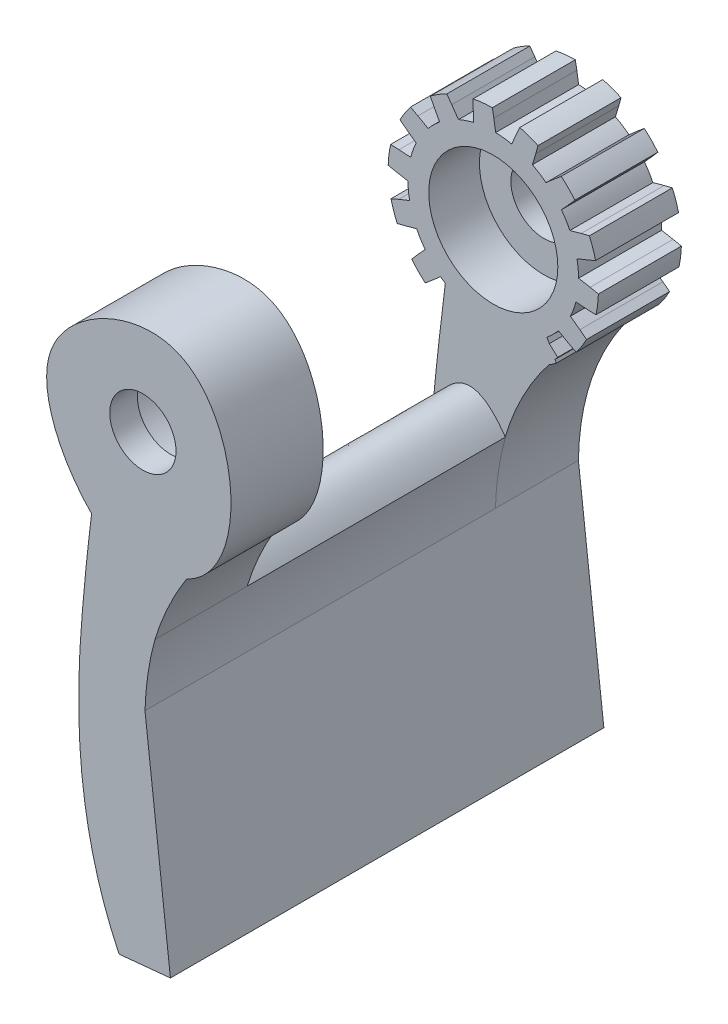
from build123d import *

# Parameters (mm, degrees)
BOSS_EXTRUDE1_DEPTH      = 2
BOSS_EXTRUDE1_DEPTH_BACK = 7
BOSS_EXTRUDE3_DEPTH      = 9
SKETCH6_R                = 7
SKETCH6_R_2              = 3.69685312
BOSS_EXTRUDE4_DEPTH      = 3
BOSS_EXTRUDE5_DEPTH      = 38
SKETCH8_R                = 7
BOSS_EXTRUDE6_DEPTH      = 10
SKETCH9_R                = 7
SKETCH9_R_2              = 3.591571222
BOSS_EXTRUDE7_DEPTH      = 3
SKETCH10_R               = 7
CUT_EXTRUDE1_DEPTH       = 5.5
SKETCH11_R               = 3.591571222
CUT_EXTRUDE2_DEPTH       = 71.546467667


with BuildPart() as part:
    # Sketch2 → Boss-Extrude1 (new, two sides: drawn at the far end of the back side and taken through both)
    with BuildSketch(Plane.XY.offset(-BOSS_EXTRUDE1_DEPTH_BACK)):
        with BuildLine():
            Line((17.593003447, 3.447921134), (18.432689254, 3.812129579))
            ThreePointArc((18.432689254, 3.812129579), (18.142308848, 4.822341152), (17.760116965, 5.801513031))
            Line((17.760116965, 5.801513031), (16.871688472, 5.581479263))
            Line((16.871688472, 5.581479263), (15.649099733, 5.241598415))
            ThreePointArc((15.649099733, 5.241598415), (15.22663553, 6.009376293), (14.733410626, 6.733729845))
            Line((14.733410626, 6.733729845), (15.590096731, 7.669855443))
            Line((15.590096731, 7.669855443), (16.188603379, 8.362321932))
            ThreePointArc((16.188603379, 8.362321932), (15.488665299, 9.146499772), (14.719475556, 9.862876308))
            Line((14.719475556, 9.862876308), (14.014498216, 9.279158058))
            Line((14.014498216, 9.279158058), (13.060452596, 8.442474621))
            ThreePointArc((13.060452596, 8.442474621), (12.346699165, 8.950918239), (11.588033655, 9.389535972))
            Line((11.588033655, 9.389535972), (11.95371149, 10.604658163))
            Line((11.95371149, 10.604658163), (12.192497398, 11.488231214))
            ThreePointArc((12.192497398, 11.488231214), (11.221632964, 11.891059284), (10.217792822, 12.202753318))
            Line((10.217792822, 12.202753318), (9.835896044, 11.370963143))
            Line((9.835896044, 11.370963143), (9.33935398, 10.203192533))
            ThreePointArc((9.33935398, 10.203192533), (8.475678941, 10.351598396), (7.601835833, 10.417606691))
            Line((7.601835833, 10.417606691), (7.404078418, 11.671055622))
            Line((7.404078418, 11.671055622), (7.235849109, 12.570732756))
            ThreePointArc((7.235849109, 12.570732756), (6.18634993, 12.512426015), (5.14668224, 12.357702722))
            Line((5.14668224, 12.357702722), (5.163505363, 11.442586867))
            Line((5.163505363, 11.442586867), (5.222813101, 10.175020376))
            ThreePointArc((5.222813101, 10.175020376), (4.380277888, 9.933994883), (3.564332526, 9.614319987))
            Line((3.564332526, 9.614319987), (2.842308143, 10.657834724))
            Line((2.842308143, 10.657834724), (2.300383494, 11.395423851))
            ThreePointArc((2.300383494, 11.395423851), (1.380115753, 10.887530665), (0.510539453, 10.297034891))
            Line((0.510539453, 10.297034891), (0.922750452, 9.479843274))
            Line((0.922750452, 9.479843274), (1.526161366, 8.363537991))
            ThreePointArc((1.526161366, 8.363537991), (0.871640411, 7.780819197), (0.275200782, 7.138776643))
            Line((0.275200782, 7.138776643), (-0.828084785, 7.765676295))
            Line((-0.828084785, 7.765676295), (-1.636369952, 8.195088843))
            ThreePointArc((-1.636369952, 8.195088843), (-2.245135941, 7.338203686), (-2.772390602, 6.42889036))
            Line((-2.772390602, 6.42889036), (-2.04643517, 5.871477804))
            Line((-2.04643517, 5.871477804), (-1.018434012, 5.12753168))
            ThreePointArc((-1.018434012, 5.12753168), (-1.355304806, 4.318534189), (-1.61410652, 3.481288379))
            Line((-1.61410652, 3.481288379), (-2.880134034, 3.567407782))
            Line((-2.880134034, 3.567407782), (-3.794688927, 3.603593329))
            ThreePointArc((-3.794688927, 3.603593329), (-3.971379595, 2.567432815), (-4.051883364, 1.519402593))
            Line((-4.051883364, 1.519402593), (-3.155967876, 1.332171491))
            Line((-3.155967876, 1.332171491), (-1.90698471, 1.107932181))
            ThreePointArc((-1.90698471, 1.107932181), (-1.859483953, 0.232887867), (-1.729388897, -0.633734398))
            Line((-1.729388897, -0.633734398), (-2.907406081, -1.105452248))
            Line((-2.907406081, -1.105452248), (-3.747091888, -1.469660694))
            ThreePointArc((-3.747091888, -1.469660694), (-3.456711482, -2.479872267), (-3.0745196, -3.459044145))
            Line((-3.0745196, -3.459044145), (-2.186091107, -3.239010378))
            Line((-2.186091107, -3.239010378), (-0.963502367, -2.899129529))
            ThreePointArc((-0.963502367, -2.899129529), (-0.541038164, -3.666907408), (-0.047813261, -4.391260959))
            Line((-0.047813261, -4.391260959), (-0.904499365, -5.327386558))
            Line((-0.904499365, -5.327386558), (-1.503006014, -6.019853046))
            ThreePointArc((-1.503006014, -6.019853046), (-0.803067933, -6.804030887), (-0.03387819, -7.520407423))
            Line((-0.03387819, -7.520407423), (0.67109915, -6.936689172))
            Line((0.67109915, -6.936689172), (1.625144769, -6.100005735))
            ThreePointArc((1.625144769, -6.100005735), (2.3388982, -6.608449353), (3.097563711, -7.047067087))
            Line((3.097563711, -7.047067087), (2.731885876, -8.262189278))
            Line((2.731885876, -8.262189278), (2.493099968, -9.145762328))
            ThreePointArc((2.493099968, -9.145762328), (3.463964401, -9.548590398), (4.467804544, -9.860284433))
            Line((4.467804544, -9.860284433), (4.849701322, -9.028494257))
            Line((4.849701322, -9.028494257), (5.346243386, -7.860723648))
            ThreePointArc((5.346243386, -7.860723648), (6.209918425, -8.009129511), (7.083761533, -8.075137806))
            Line((7.083761533, -8.075137806), (7.281518948, -9.328586736))
            Line((7.281518948, -9.328586736), (7.449748257, -10.22826387))
            ThreePointArc((7.449748257, -10.22826387), (8.499247436, -10.16995713), (9.538915126, -10.015233837))
            Line((9.538915126, -10.015233837), (9.522092003, -9.100117982))
            Line((9.522092003, -9.100117982), (9.462784265, -7.83255149))
            ThreePointArc((9.462784265, -7.83255149), (10.305319478, -7.591525998), (11.12126484, -7.271851101))
            Line((11.12126484, -7.271851101), (11.843289223, -8.315365839))
            Line((11.843289223, -8.315365839), (12.385213872, -9.052954966))
            ThreePointArc((12.385213872, -9.052954966), (13.305481612, -8.54506178), (14.175057913, -7.954566005))
            Line((14.175057913, -7.954566005), (13.762846914, -7.137374389))
            Line((13.762846914, -7.137374389), (13.159436, -6.021069105))
            ThreePointArc((13.159436, -6.021069105), (13.813956955, -5.438350311), (14.410396584, -4.796307757))
            Line((14.410396584, -4.796307757), (15.513682151, -5.42320741))
            Line((15.513682151, -5.42320741), (16.321967317, -5.852619957))
            ThreePointArc((16.321967317, -5.852619957), (16.930733307, -4.9957348), (17.457987967, -4.086421474))
            Line((17.457987967, -4.086421474), (16.732032536, -3.529008918))
            Line((16.732032536, -3.529008918), (15.704031377, -2.785062794))
            ThreePointArc((15.704031377, -2.785062794), (16.040902172, -1.976065303), (16.299703886, -1.138819493))
            Line((16.299703886, -1.138819493), (17.565731399, -1.224938896))
            Line((17.565731399, -1.224938896), (18.480286292, -1.261124443))
            ThreePointArc((18.480286292, -1.261124443), (18.656976961, -0.22496393), (18.737480729, 0.823066292))
            Line((18.737480729, 0.823066292), (17.841565242, 1.010297394))
            Line((17.841565242, 1.010297394), (16.592582076, 1.234536705))
            ThreePointArc((16.592582076, 1.234536705), (16.545081318, 2.109581019), (16.414986263, 2.976203284))
            Line((16.414986263, 2.976203284), (17.593003447, 3.447921134))
        make_face()
    extrude(amount=BOSS_EXTRUDE1_DEPTH + BOSS_EXTRUDE1_DEPTH_BACK)

    # Sketch5 → Boss-Extrude3 (add)
    with BuildSketch(Plane.XY.offset(2)):
        with BuildLine():
            Line((14.323069399, -7.330284288), (11.497184032, -4.736041982))
            Line((11.497184032, -4.736041982), (2.348634103, -4.736041982))
            add(Edge.make_bspline(
                [(2.348634103, -4.736041982), (0.628552499, -19.32789347), (-1.912663, -35.361500183), (4.763482553, -49.160053836)],
                knots=[0, 0, 0, 0, 1, 1, 1, 1], degree=3))
            Line((4.763482553, -49.160053836), (10.332905106, -48.613760737))
            Line((10.332905106, -48.613760737), (7.574511186, -24.888738823))
            add(Edge.make_bspline(
                [(14.323069399, -7.330284288), (7.759285057, -14.975557189), (7.574511186, -24.888738823)],
                knots=[0, 0, 0, 1, 1, 1], degree=2))
        make_face()
    extrude(amount=-BOSS_EXTRUDE3_DEPTH)

    # Sketch6 → Boss-Extrude4 (add)
    with BuildSketch(Plane(origin=(0, 0, -7), x_dir=(-1, 0, 0), z_dir=(0, 0, -1))):
        with Locations((-7.342798683, 1.171234443)):
            Circle(SKETCH6_R)
        with Locations((-7.342798683, 1.171234443)):
            Circle(SKETCH6_R_2, mode=Mode.SUBTRACT)
    extrude(amount=-BOSS_EXTRUDE4_DEPTH)

    # Sketch7 → Boss-Extrude5 (add)
    with BuildSketch(Plane.XY.offset(2)):
        with BuildLine():
            Line((4.763482553, -49.160053836), (10.332905106, -48.613760737))
            Line((10.332905106, -48.613760737), (7.574511187, -24.888738781))
            add(Edge.make_bspline(
                [(7.574511187, -24.888738781), (7.686436039, -21.137993885), (8.653774634, -17.660128373)],
                knots=[0, 0, 0, 1, 1, 1], degree=2))
            add(Edge.make_bspline(
                [(0.854001662, -18.172152661), (4.511582235, -11.66623094), (8.653774634, -17.660128373)],
                knots=[0, 0, 0, 1, 1, 1], degree=2))
            add(Edge.make_bspline(
                [(0.854001662, -18.172152661), (-0.132777517, -28.73684408), (0.123220881, -39.513312679), (4.763482553, -49.160053836)],
                knots=[0.2758018, 0.2758018, 0.2758018, 0.2758018, 1, 1, 1, 1], degree=3))
        make_face()
    extrude(amount=BOSS_EXTRUDE5_DEPTH)

    # Sketch8 → Boss-Extrude6 (add)
    with BuildSketch(Plane.XY.offset(40)):
        with BuildLine():
            add(Edge.make_bspline(
                [(8.161452368, -19.485656093), (9.314674226, -14.585302427), (12.103080861, -10.251209775)],
                knots=[0, 0, 0, 1, 1, 1], degree=2))
            add(Edge.make_bspline(
                [(1.784517867, -9.294701523), (-1.285057106, -6.227479148), (-7.467073574, 5.277430619), (17.020799468, 17.744922671), (19.383717346, -6.805513304), (12.103080861, -10.251209775)],
                knots=[0, 0, 0, 0, 0.273426671, 0.5551446, 1, 1, 1, 1], degree=3))
            add(Edge.make_bspline(
                [(1.784517867, -9.294701523), (1.392693521, -12.484419655), (1.032610994, -15.724984195), (0.780859851, -18.982230478)],
                knots=[0.071303054, 0.071303054, 0.071303054, 0.071303054, 0.275801801, 0.275801801, 0.275801801, 0.275801801], degree=3))
            add(Edge.make_bspline(
                [(0.780859851, -18.982230478), (4.753063038, -11.185515123), (8.161452368, -19.485656093)],
                knots=[0, 0, 0, 1, 1, 1], degree=2))
        make_face()
        with Locations((7.342798683, 1.171234443)):
            Circle(SKETCH8_R, mode=Mode.SUBTRACT)
    extrude(amount=-BOSS_EXTRUDE6_DEPTH)

    # Sketch9 → Boss-Extrude7 (add)
    with BuildSketch(Plane.XY.offset(40)):
        with Locations((7.342798683, 1.171234443)):
            Circle(SKETCH9_R)
        with Locations((7.342798683, 1.171234443)):
            Circle(SKETCH9_R_2, mode=Mode.SUBTRACT)
    extrude(amount=-BOSS_EXTRUDE7_DEPTH)

    # Sketch10 → Cut-Extrude1 (cut)
    with BuildSketch(Plane.XY.offset(2)):
        with Locations((7.342798683, 1.171234443)):
            Circle(SKETCH10_R)
    extrude(amount=-CUT_EXTRUDE1_DEPTH, mode=Mode.SUBTRACT)

    # Sketch11 → Cut-Extrude2 (cut, through all)
    with BuildSketch(Plane(origin=(0, 0, -7), x_dir=(-1, 0, 0), z_dir=(0, 0, -1))):
        with Locations(Location((-7.342798683, 1.171234443, 0), (0, 0, 180))):
            Circle(SKETCH11_R)
    extrude(amount=-CUT_EXTRUDE2_DEPTH, mode=Mode.SUBTRACT)


solid = part.part
